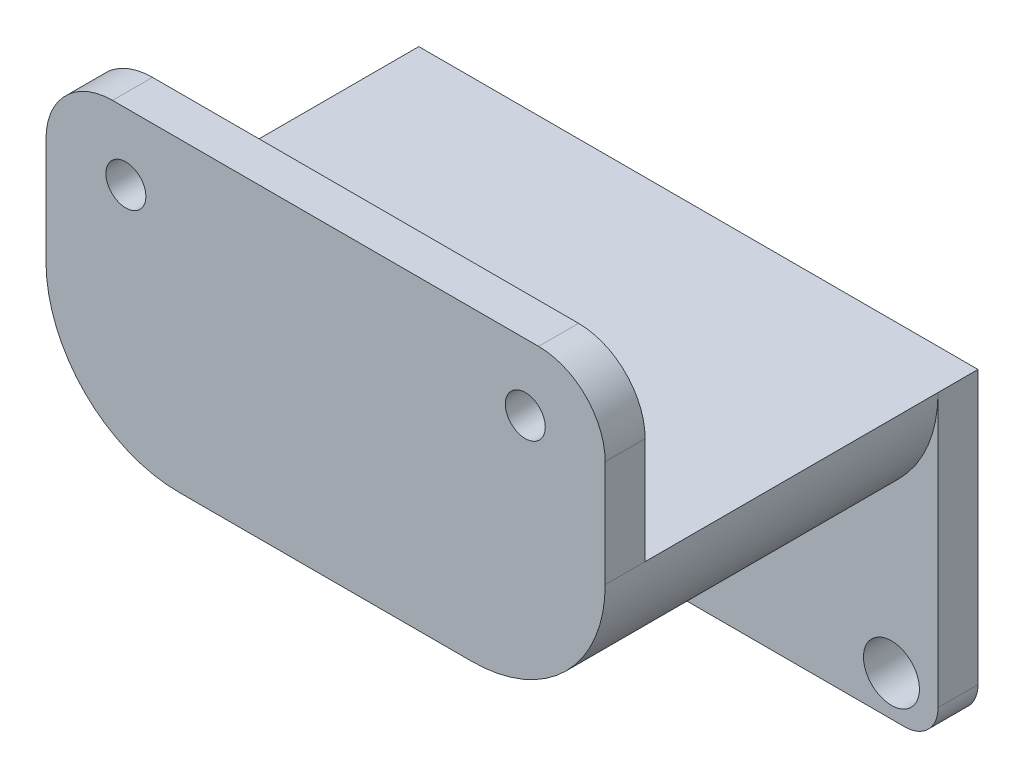
from build123d import *

# Parameters (mm, degrees)
SKETCH3_R           = 1.5
BOSS_EXTRUDE3_DEPTH = 3
BOSS_EXTRUDE4_START = -25
BOSS_EXTRUDE4_DEPTH = 25
FILLET4_R           = 5
SKETCH9_W           = 42
SKETCH9_H           = 3
BOSS_EXTRUDE7_DEPTH = 30
FILLET6_R           = 5
FILLET7_R           = 5
SKETCH11_R          = 2.1
CUT_EXTRUDE2_DEPTH  = 30
SKETCH12_W          = 44.285709781
SKETCH12_H          = 8.726500344
CUT_EXTRUDE3_DEPTH  = 10
FILLET8_R           = 2.5


with BuildPart() as part:
    # Sketch3 → Boss-Extrude3 (new body)
    with BuildSketch(Plane.XY):
        with BuildLine():
            Line((-22.592834793, 16.50935751), (-6.092834793, 16.50935751))
            Line((-6.092834793, 16.50935751), (-6.092834793, 3.50935751))
            ThreePointArc((-6.092834793, 3.50935751), (-9.021766981, -3.561710302), (-16.092834793, -6.49064249))
            Line((-16.092834793, -6.49064249), (-38.092834793, -6.49064249))
            ThreePointArc((-38.092834793, -6.49064249), (-45.163902605, -3.561710302), (-48.092834793, 3.50935751))
            Line((-48.092834793, 3.50935751), (-48.092834793, 16.50935751))
            Line((-48.092834793, 16.50935751), (-31.592834793, 16.50935751))
            Line((-31.592834793, 16.50935751), (-22.592834793, 16.50935751))
        make_face()
        with Locations((-42.092834793, 11.50935751)):
            Circle(SKETCH3_R, mode=Mode.SUBTRACT)
        with Locations((-12.092834793, 11.50935751)):
            Circle(SKETCH3_R, mode=Mode.SUBTRACT)
    extrude(amount=BOSS_EXTRUDE3_DEPTH)

    # Sketch6 → Boss-Extrude4 (add)
    with BuildSketch(Plane.XY.offset(BOSS_EXTRUDE4_START)):
        with BuildLine():
            Line((-38.092834793, -6.49064249), (-16.092834793, -6.49064249))
            ThreePointArc((-16.092834793, -6.49064249), (-9.021766981, -3.561710302), (-6.092834793, 3.50935751))
            Line((-6.092834793, 3.50935751), (-48.092834793, 3.50935751))
            ThreePointArc((-48.092834793, 3.50935751), (-45.163902605, -3.561710302), (-38.092834793, -6.49064249))
        make_face()
    extrude(amount=BOSS_EXTRUDE4_DEPTH)

    # Fillet4
    fillet4_edges = [part.edges().sort_by_distance(p)[0] for p in [
        (-48.092834793, 16.50935751, 1.5),
        (-6.092834793, 16.50935751, 1.5),
    ]]
    fillet(fillet4_edges, radius=FILLET4_R)

    # Sketch9 → Boss-Extrude7 (add)
    with BuildSketch(Plane(origin=(0, 3.50935751, 0), x_dir=(1, 0, 0), z_dir=(0, 1, 0))):
        with Locations((-27.092834793, 23.5)):
            Rectangle(SKETCH9_W, SKETCH9_H)
    extrude(amount=-BOSS_EXTRUDE7_DEPTH)

    # Fillet6
    fillet6_edges = [part.edges().sort_by_distance(p)[0] for p in [
        (-6.092834793, -26.49064249, -23.5),
    ]]
    fillet(fillet6_edges, radius=FILLET6_R)

    # Fillet7
    fillet7_edges = [part.edges().sort_by_distance(p)[0] for p in [
        (-48.092834793, -26.49064249, -23.5),
    ]]
    fillet(fillet7_edges, radius=FILLET7_R)

    # Sketch11 → Cut-Extrude2 (cut)
    with BuildSketch(Plane(origin=(0, 0, -25), x_dir=(-1, 0, 0), z_dir=(0, 0, -1))):
        with Locations((9.592834793, -16.49064249)):
            Circle(SKETCH11_R)
        with Locations((44.592834793, -16.49064249)):
            Circle(SKETCH11_R)
        with BuildLine():
            Line((22.592834793, -24.49064249), (31.592834793, -24.49064249))
            ThreePointArc((31.592834793, -24.49064249), (27.092834793, -19.99064249), (22.592834793, -24.49064249))
        make_face()
    extrude(amount=-CUT_EXTRUDE2_DEPTH, mode=Mode.SUBTRACT)

    # Sketch12 → Cut-Extrude3 (cut)
    with BuildSketch(Plane(origin=(0, 0, -25), x_dir=(-1, 0, 0), z_dir=(0, 0, -1))):
        with Locations((28.235689684, -23.853892662)):
            Rectangle(SKETCH12_W, SKETCH12_H)
    extrude(amount=-CUT_EXTRUDE3_DEPTH, mode=Mode.SUBTRACT)

    # Fillet8
    fillet8_edges = [part.edges().sort_by_distance(p)[0] for p in [
        (-48.092834793, -19.49064249, -23.5),
        (-6.092834793, -19.49064249, -23.5),
    ]]
    fillet(fillet8_edges, radius=FILLET8_R)


solid = part.part
